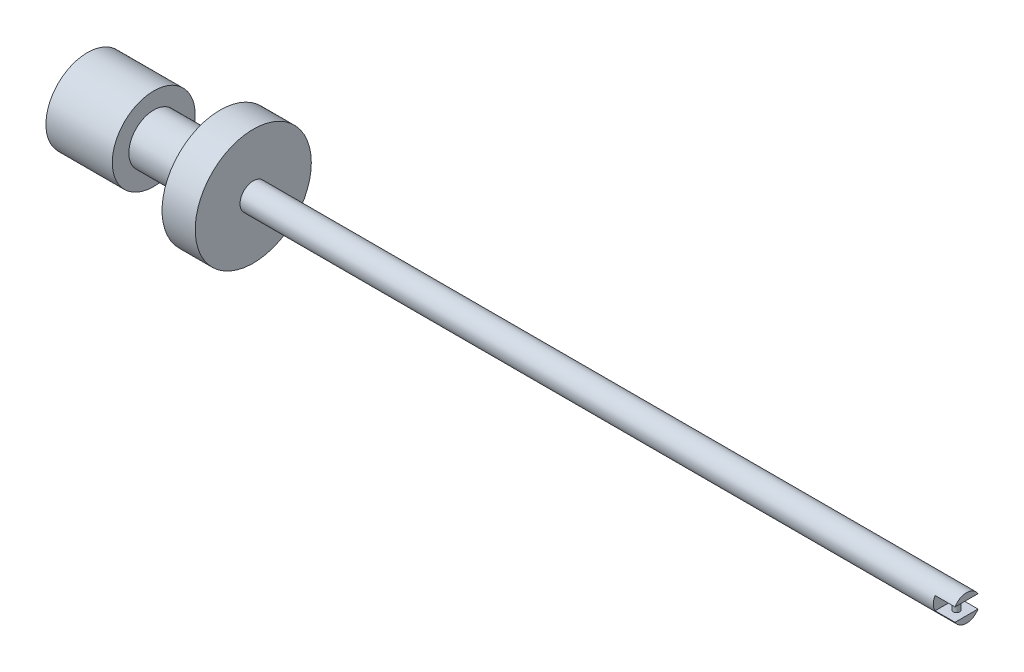
from build123d import *

# Parameters (mm, degrees)
SKETCH1_R           = 12.5
BOSS_EXTRUDE1_DEPTH = 20
SKETCH2_R           = 7.5
BOSS_EXTRUDE2_DEPTH = 20
SKETCH3_R           = 17.5
BOSS_EXTRUDE3_DEPTH = 10
SKETCH4_R           = 4
BOSS_EXTRUDE4_DEPTH = 215
SKETCH5_W           = 12
SKETCH5_H           = 4
CUT_EXTRUDE1_DEPTH  = 6
SKETCH6_R           = 1
BOSS_EXTRUDE5_DEPTH = 4


with BuildPart() as part:
    # Sketch1 → Boss-Extrude1 (new body)
    with BuildSketch(Plane(origin=(0, 0, 0), x_dir=(0, 0, -1), z_dir=(1, 0, 0))):
        Circle(SKETCH1_R)
    extrude(amount=BOSS_EXTRUDE1_DEPTH)

    # Sketch2 → Boss-Extrude2 (add)
    with BuildSketch(Plane(origin=(20, 0, 0), x_dir=(0, 0, -1), z_dir=(1, 0, 0))):
        Circle(SKETCH2_R)
    extrude(amount=BOSS_EXTRUDE2_DEPTH)

    # Sketch3 → Boss-Extrude3 (add)
    with BuildSketch(Plane(origin=(40, 0, 0), x_dir=(0, 0, -1), z_dir=(1, 0, 0))):
        Circle(SKETCH3_R)
    extrude(amount=BOSS_EXTRUDE3_DEPTH)

    # Sketch4 → Boss-Extrude4 (add)
    with BuildSketch(Plane(origin=(50, 0, 0), x_dir=(0, 0, -1), z_dir=(1, 0, 0))):
        Circle(SKETCH4_R)
    extrude(amount=BOSS_EXTRUDE4_DEPTH)

    # Sketch5 → Cut-Extrude1 (cut)
    with BuildSketch(Plane(origin=(265, 0, 0), x_dir=(0, 0, -1), z_dir=(1, 0, 0))):
        Rectangle(SKETCH5_W, SKETCH5_H)
    extrude(amount=-CUT_EXTRUDE1_DEPTH, mode=Mode.SUBTRACT)

    # Sketch6 → Boss-Extrude5 (add)
    with BuildSketch(Plane(origin=(0, -2, 0), x_dir=(1, 0, 0), z_dir=(0, 1, 0))):
        with Locations(Location((262, 0, 0), (0, 0, 90))):
            Circle(SKETCH6_R)
    extrude(amount=BOSS_EXTRUDE5_DEPTH)


solid = part.part
